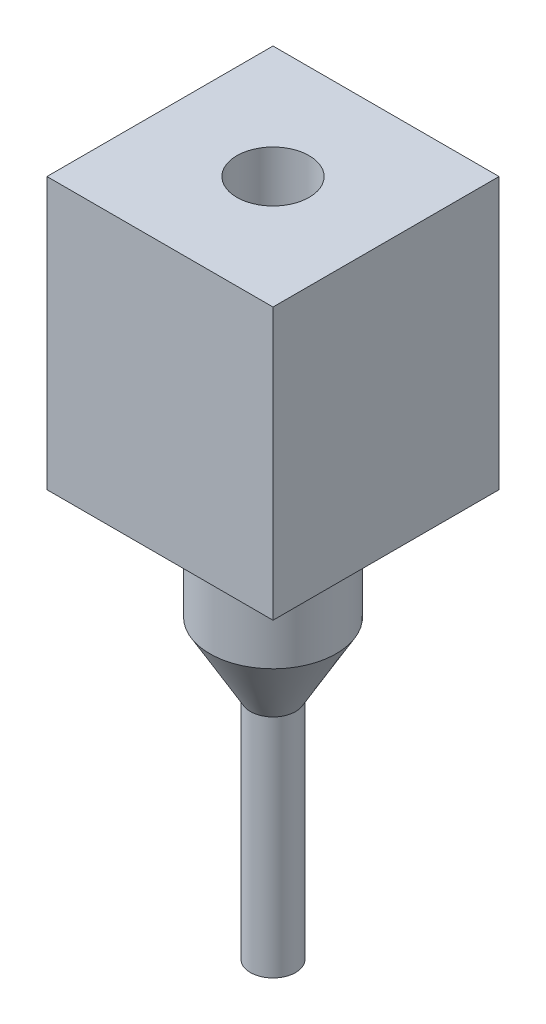
from build123d import *

# Parameters (mm, degrees)
SKETCH_1_W          = 2.5
SKETCH_1_H          = 2.5
EXTRUDE_1_DEPTH     = 3
SKETCH_2_R          = 0.7
EXTRUDE_2_DEPTH     = 2
CHAMFER_1_SIZE      = 0.779422863
CHAMFER_1_SIZE2     = 0.45
SKETCH_3_R          = 0.25
EXTRUDE_3_DEPTH     = 2.5
SKETCH_4_R          = 0.4
CUT_EXTRUDE_1_DEPTH = 2.5


with BuildPart() as part:
    # Эскиз1 → Бобышка-Вытянуть1 (new body)
    with BuildSketch(Plane(origin=(0, 0, 0), x_dir=(1, 0, 0), z_dir=(0, 1, 0))):
        Rectangle(SKETCH_1_W, SKETCH_1_H)
    extrude(amount=EXTRUDE_1_DEPTH)

    # Эскиз2 → Бобышка-Вытянуть2 (add)
    with BuildSketch(Plane.XZ):
        with Locations(Location((0, 0, 0), (0, 0, 270))):
            Circle(SKETCH_2_R)
    extrude(amount=EXTRUDE_2_DEPTH)

    # Фаска1
    chamfer_1_edges = [part.edges().sort_by_distance(p)[0] for p in [
        (0, -2, 0.7),
    ]]
    chamfer_1_side = [part.faces().sort_by_distance(p)[0] for p in [
        (0, -1, 0.7),
    ]]
    chamfer(chamfer_1_edges, length=CHAMFER_1_SIZE, length2=CHAMFER_1_SIZE2, reference=chamfer_1_side[0])

    # Эскиз3 → Бобышка-Вытянуть3 (add)
    with BuildSketch(Plane.XZ.offset(2)):
        with Locations(Location((0, 0, 0), (0, 0, 270))):
            Circle(SKETCH_3_R)
    extrude(amount=EXTRUDE_3_DEPTH)

    # Эскиз4 → Вырез-Вытянуть1 (cut)
    with BuildSketch(Plane(origin=(0, 3, 0), x_dir=(1, 0, 0), z_dir=(0, 1, 0))):
        with Locations(Location((0, 0, 0), (0, 0, 270))):
            Circle(SKETCH_4_R)
    extrude(amount=-CUT_EXTRUDE_1_DEPTH, mode=Mode.SUBTRACT)


solid = part.part
